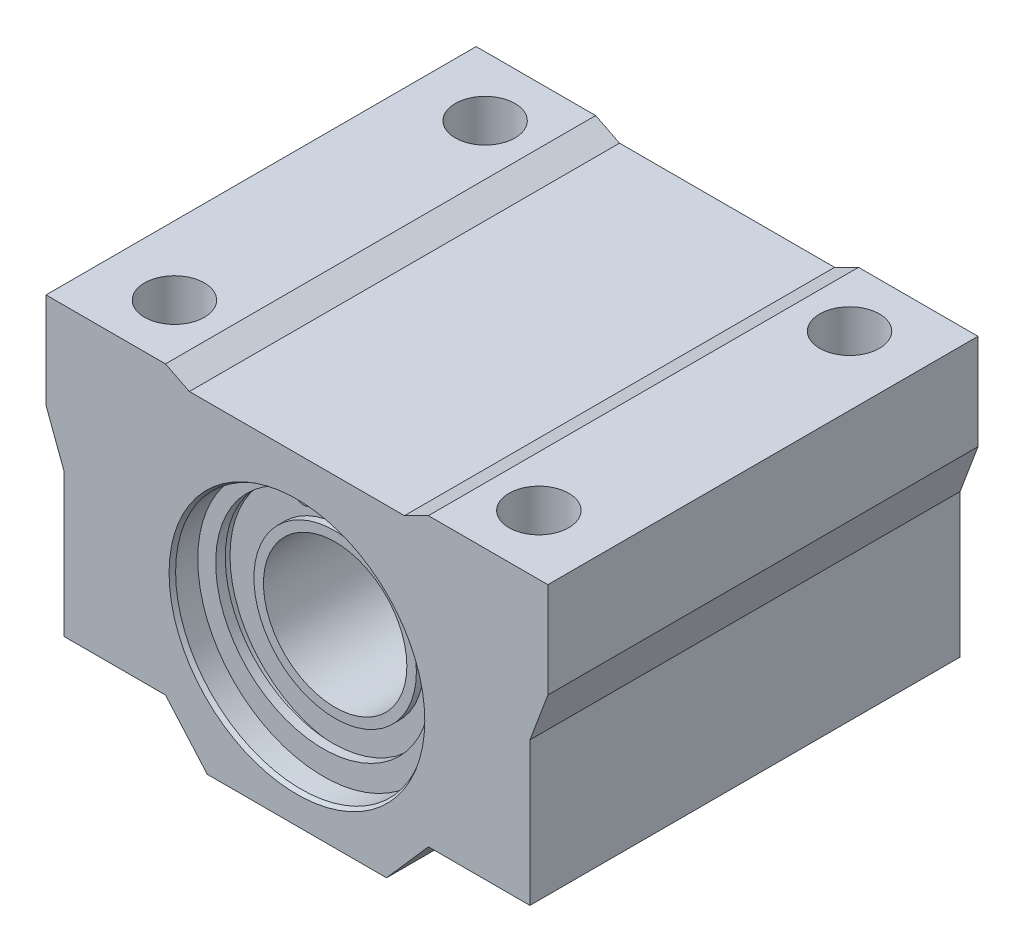
from build123d import *
from OCP.BRepFilletAPI import BRepFilletAPI_MakeChamfer

# Parameters (mm, degrees)
SKETCH1_R                  = 10.5
BOSS_EXTRUDE1_DEPTH        = 18
SKETCH3_R                  = 0.487346303
BOSS_EXTRUDE2_DEPTH        = 0.8
M5_TAPPED_HOLE1_AT_2_COUNT = 2
M5_TAPPED_HOLE1_AT_2_PITCH = 26
M5_TAPPED_HOLE1_AT_3_COUNT = 2
M5_TAPPED_HOLE1_AT_3_PITCH = 30.5
M5_TAPPED_HOLE1_AT_4_COUNT = 2
M5_TAPPED_HOLE1_AT_4_PITCH = 40.078048855
CHAMFER1_SIZE              = 0.2
CHAMFER1_SIZE2             = 0.346410162


with BuildPart() as part:
    # Sketch1 → Boss-Extrude1 (new, symmetric)
    with BuildSketch(Plane.XY):
        Polygon((-9, -1), (9, -1), (11, 0), (21, 0), (21, -8), (19.5, -12), (19.5, -24), (11, -24), (7.5, -28), (-7.5, -28), (-11, -24), (-19.5, -24), (-19.5, -12), (-21, -8), (-21, 0), (-11, 0), align=None)
        with Locations((0, -15)):
            Circle(SKETCH1_R, mode=Mode.SUBTRACT)
    extrude(amount=BOSS_EXTRUDE1_DEPTH, both=True)

    # Sketch2 → Revolve1 (revolve)
    with BuildSketch(Plane(origin=(0, 0, 0), x_dir=(0, 0, -1), z_dir=(1, 0, 0)), mode=Mode.PRIVATE) as revolve1_sk:
        Polygon((-15, -4.5), (15, -4.5), (15, -5.6), (14.2, -5.6), (14.2, -8.2), (14.8, -8.2), (14.8, -9), (-14.8, -9), (-14.8, -8.2), (-14.2, -8.2), (-14.2, -5.6), (-15, -5.6), align=None)
    revolve(revolve1_sk.sketch.rotate(Axis((0, -15, 30.2753079), (0, 0, -1)), 90), axis=Axis((0, -15, 30.2753079), (0, 0, -1)))

    # Sketch3 → Boss-Extrude2 (add)
    with BuildSketch(Plane.XY.offset(15)):
        with BuildLine():
            Line((1.141194716, -4.059356755), (0.782998979, -5.534631753))
            ThreePointArc((0.782998979, -5.534631753), (1.493962208, -6.63757679), (2.559436926, -5.871600228))
            ThreePointArc((2.559436926, -5.871600228), (0, -23.5), (-2.559436926, -5.871600228))
            ThreePointArc((-2.559436926, -5.871600228), (-1.493962208, -6.63757679), (-0.782998979, -5.534631753))
            Line((-0.782998979, -5.534631753), (-1.141194716, -4.059356755))
            ThreePointArc((-1.141194716, -4.059356755), (0, -26), (1.141194716, -4.059356755))
        make_face()
        with Locations(Location((1.662663475, -5.748213677, 0), (0, 0, 171.29739801))):
            Circle(SKETCH3_R, mode=Mode.SUBTRACT)
        with Locations(Location((-1.662663475, -5.748213677, 0), (0, 0, 180))):
            Circle(SKETCH3_R, mode=Mode.SUBTRACT)
    boss_extrude2 = extrude(amount=BOSS_EXTRUDE2_DEPTH)

    # Mirror1: Boss-Extrude2 across plane
    add(boss_extrude2.mirror(Plane.XY))

    # Sketch6 → M5 Tapped Hole1 (revolve, cut)
    with BuildSketch(Plane(origin=(15.25, 0, -13), x_dir=(0, 0, 1), z_dir=(1, 0, 0))):
        Polygon((0, 0), (0, 24), (2.5, 24), (2.1, 23.6), (2.1, 12), (2.5, 12), (2.5, 0), align=None)
    m5_tapped_hole1 = revolve(axis=Axis((15.25, 6.35, -13), (0, -1, 0)), mode=Mode.SUBTRACT)

    # M5 Tapped Hole1 at 2: M5 Tapped Hole1 ×2
    with Locations(*[(0, 0, i * M5_TAPPED_HOLE1_AT_2_PITCH) for i in range(1, M5_TAPPED_HOLE1_AT_2_COUNT)]):
        add(m5_tapped_hole1, mode=Mode.SUBTRACT)

    # M5 Tapped Hole1 at 3: M5 Tapped Hole1 ×2
    with Locations(*[(-i * M5_TAPPED_HOLE1_AT_3_PITCH, 0, 0) for i in range(1, M5_TAPPED_HOLE1_AT_3_COUNT)]):
        add(m5_tapped_hole1, mode=Mode.SUBTRACT)

    # M5 Tapped Hole1 at 4: M5 Tapped Hole1 ×2
    with Locations(*[Vector(-0.7610150910932025, 0, 0.6487341760138777) * (i * M5_TAPPED_HOLE1_AT_4_PITCH) for i in range(1, M5_TAPPED_HOLE1_AT_4_COUNT)]):
        add(m5_tapped_hole1, mode=Mode.SUBTRACT)

    # Chamfer1: one chamfer whose edges measure the first distance from different faces: ONE call of the kernel's chamfer builder (chamfer() names one face for all edges)
    chamfer1_edges_1 = [part.edges().sort_by_distance(p)[0] for p in [
        (-10.5, -15, -18),
    ]]
    chamfer1_side_1 = [part.faces().sort_by_distance(p)[0] for p in [
        (-10.5, -15, -16.5),
    ]]
    chamfer1_edges_2 = [part.edges().sort_by_distance(p)[0] for p in [
        (-10.5, -15, 18),
    ]]
    chamfer1_side_2 = [part.faces().sort_by_distance(p)[0] for p in [
        (0, -1.504777179, 18),
    ]]
    chamfer1 = BRepFilletAPI_MakeChamfer(part.part.solid().wrapped)
    for e in chamfer1_edges_1:
        chamfer1.Add(CHAMFER1_SIZE, CHAMFER1_SIZE2, e.wrapped, chamfer1_side_1[0].wrapped)  # the first distance lies on this face
    for e in chamfer1_edges_2:
        chamfer1.Add(CHAMFER1_SIZE, CHAMFER1_SIZE2, e.wrapped, chamfer1_side_2[0].wrapped)  # the first distance lies on this face
    add(Compound.cast(chamfer1.Shape()), mode=Mode.REPLACE)


solid = part.part
